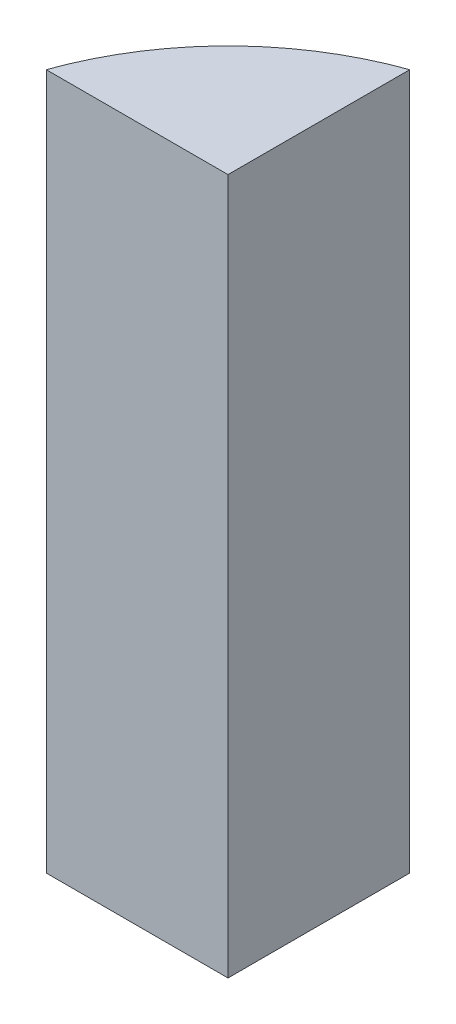
from build123d import *

# Parameters (mm, degrees)
EXTRUDE_1_DEPTH = 140


with BuildPart() as part:
    # 草图1 → 凸台-拉伸1 (new body)
    with BuildSketch(Plane(origin=(0, 0, 0), x_dir=(1, 0, 0), z_dir=(0, 1, 0))):
        with BuildLine():
            ThreePointArc((-20, 56.568542495), (-42.426406871, 42.426406871), (-56.568542495, 20))
            Line((-56.568542495, 20), (-20, 20))
            Line((-20, 20), (-20, 56.568542495))
        make_face()
    extrude(amount=EXTRUDE_1_DEPTH)


solid = part.part
